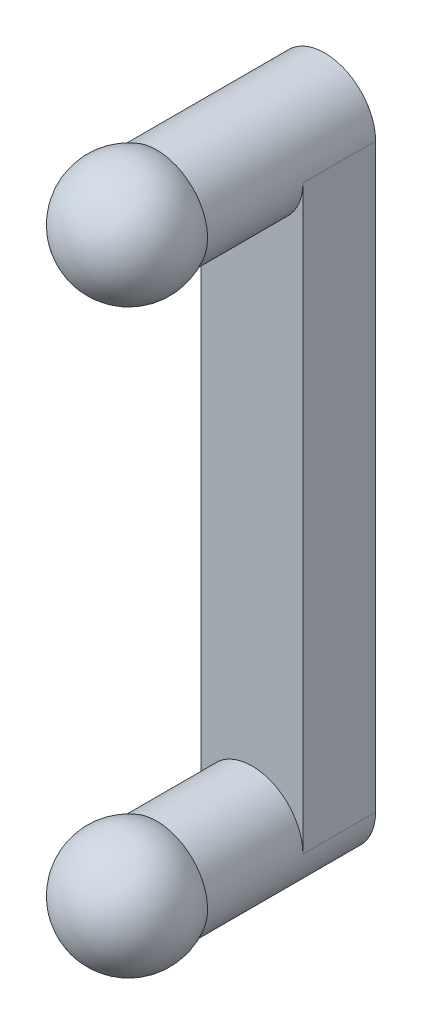
from build123d import *

# Parameters (mm, degrees)
SKETCH_5_W      = 2.8
SKETCH_5_H      = 8
EXTRUDE_1_DEPTH = 2


with BuildPart() as part:
    # 草图4 → 旋转1 (revolve)
    with BuildSketch(Plane(origin=(0, 0, 0), x_dir=(1, 0, 0), z_dir=(0, 1, 0))):
        with BuildLine():
            Line((0, -3.8), (0, 0))
            Line((0, 0), (-1.4, 0))
            Line((-1.4, 0), (-1.4, -4.625403331))
            ThreePointArc((-1.4, -4.625403331), (-0.812602403, -4.021712173), (0, -3.8))
        make_face()
        with BuildLine():
            Line((-1.4, -6.174596669), (-1.4, -4.625403331))
            ThreePointArc((-1.4, -4.625403331), (-1.6, -5.4), (-1.4, -6.174596669))
        make_face()
        with BuildLine():
            Line((0, -7), (0, -3.8))
            ThreePointArc((0, -3.8), (-0.812602403, -4.021712173), (-1.4, -4.625403331))
            Line((-1.4, -4.625403331), (-1.4, -6.174596669))
            ThreePointArc((-1.4, -6.174596669), (-0.812602403, -6.778287827), (0, -7))
        make_face()
    revolve(axis=Axis((0, 0, -1.647649903), (0, 0, 1)))

    # 草图5 → 凸台-拉伸1 (add)
    with BuildSketch(Plane(origin=(0, 0, 0), x_dir=(-1, 0, 0), z_dir=(0, 0, -1))):
        with Locations((0, 4)):
            Rectangle(SKETCH_5_W, SKETCH_5_H)
    extrude(amount=-EXTRUDE_1_DEPTH)

    # 镜向1: part across plane


with BuildPart() as part_1:
    add(part.part)
    add(part.part.mirror(Plane(origin=(1.4, 8, 2), x_dir=(0, 0, 1), z_dir=(0, 1, 0))))


solid = part_1.part
